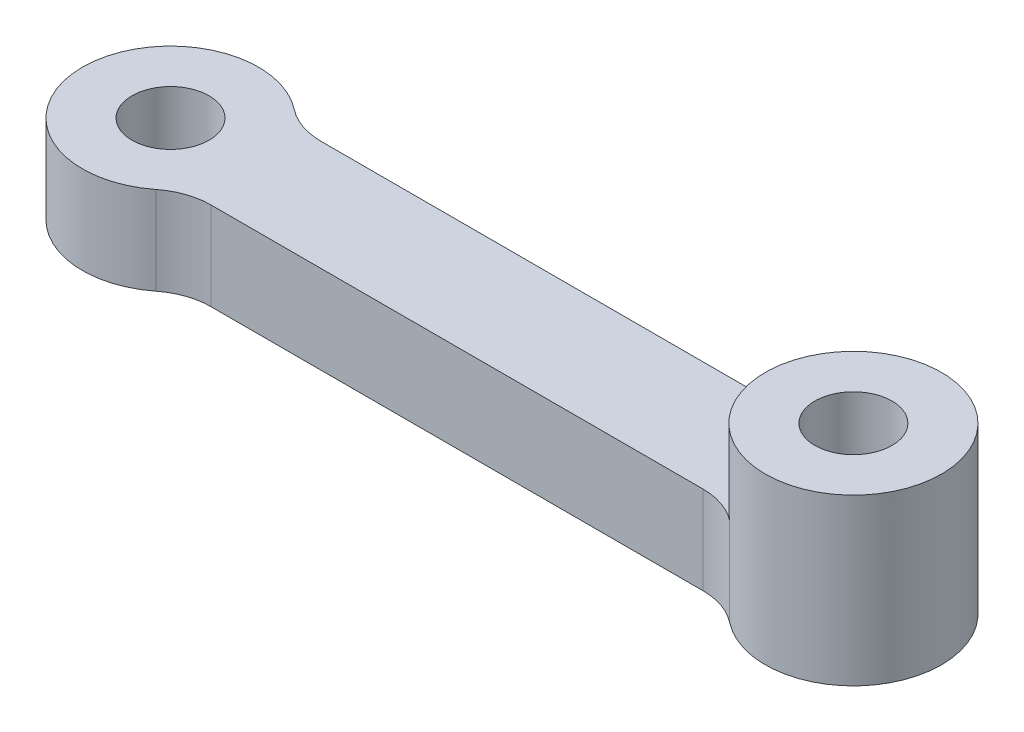
from build123d import *

# Parameters (mm, degrees)
SKETCH1_R           = 1.75
BOSS_EXTRUDE1_DEPTH = 4
SKETCH2_R           = 4
SKETCH2_R_2         = 1.75
BOSS_EXTRUDE2_DEPTH = 3.5


with BuildPart() as part:
    # Sketch1 → Boss-Extrude1 (new body)
    with BuildSketch(Plane.XZ):
        with BuildLine():
            Line((26.669872981, 2.5), (4.330127019, 2.5))
            ThreePointArc((4.330127019, 2.5), (3.348146513, 2.665266452), (2.474358297, 3.142857143))
            ThreePointArc((2.474358297, 3.142857143), (-4, 0), (2.474358297, -3.142857143))
            ThreePointArc((2.474358297, -3.142857143), (3.348146513, -2.665266452), (4.330127019, -2.5))
            Line((4.330127019, -2.5), (26.669872981, -2.5))
            ThreePointArc((26.669872981, -2.5), (27.651853487, -2.665266452), (28.525641703, -3.142857143))
            ThreePointArc((28.525641703, -3.142857143), (35, 0), (28.525641703, 3.142857143))
            ThreePointArc((28.525641703, 3.142857143), (27.651853487, 2.665266452), (26.669872981, 2.5))
        make_face()
        with Locations(Location((31, 0, 0), (0, 0, 90))):
            Circle(SKETCH1_R, mode=Mode.SUBTRACT)
        with Locations(Location((0, 0, 0), (0, 0, 90))):
            Circle(SKETCH1_R, mode=Mode.SUBTRACT)
    extrude(amount=-BOSS_EXTRUDE1_DEPTH)

    # Sketch2 → Boss-Extrude2 (add)
    with BuildSketch(Plane(origin=(0, 4, 0), x_dir=(1, 0, 0), z_dir=(0, 1, 0))):
        with Locations(Location((31, 0, 0), (0, 0, 128.213210702))):
            Circle(SKETCH2_R)
        with Locations(Location((31, 0, 0), (0, 0, 270))):
            Circle(SKETCH2_R_2, mode=Mode.SUBTRACT)
    extrude(amount=BOSS_EXTRUDE2_DEPTH)


solid = part.part
